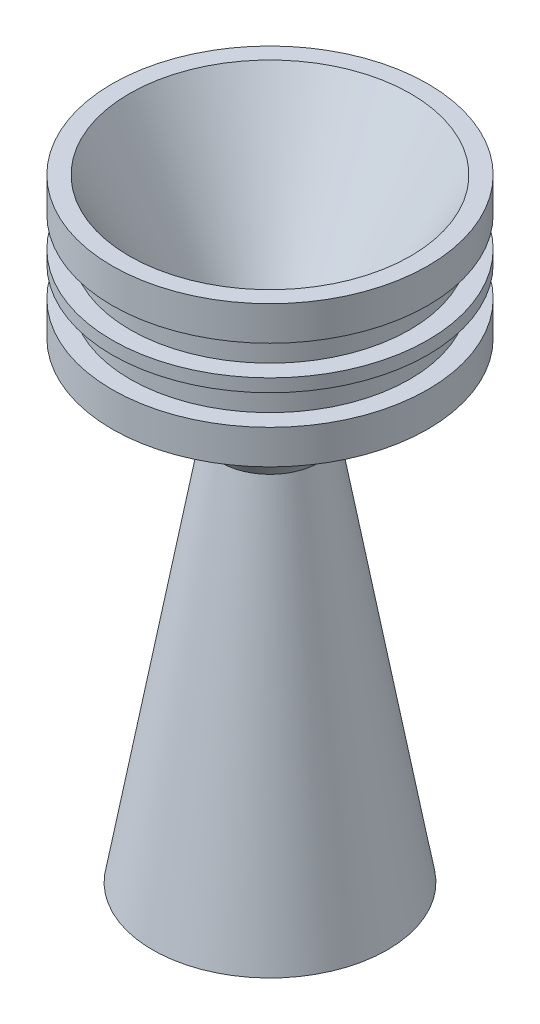
from build123d import *


with BuildPart() as part:
    # Esboço1 → Revolução1 (revolve)
    with BuildSketch(Plane.XY):
        Polygon((-18.42, 7.393122208), (-11.470597734, 7.393122208), (-5.71670102, -2.345421559), (-13.698139918, -47.610410876), (-12.175, -47.610410876), (-3.78, 0), (-3.78, 2), (-16.42, 23.893122208), (-18.42, 23.893122208), (-18.42, 19.893122208), (-16.32, 19.893122208), (-16.32, 16.393122208), (-18.42, 16.393122208), (-18.42, 14.893122208), (-16.32, 14.893122208), (-16.32, 11.393122208), (-18.42, 11.393122208), align=None)
    revolve(axis=Axis((0, 41.74917716, 0), (0, -1, 0)))


solid = part.part
